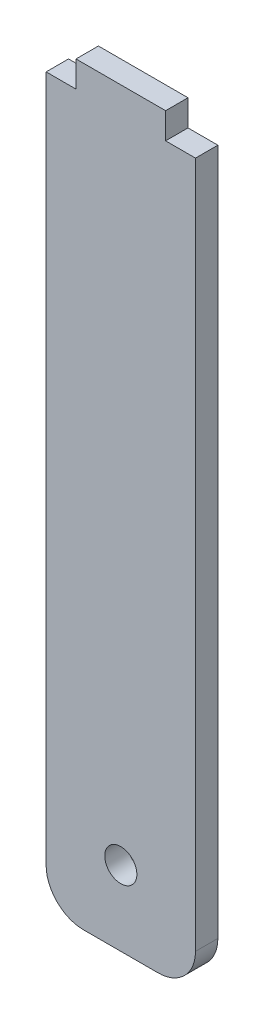
from build123d import *

# Parameters (mm, degrees)
SKETCH_1_R      = 2.15
EXTRUDE_1_DEPTH = 3
FILLET_1_R      = 5


with BuildPart() as part:
    # 草图1 → 凸台-拉伸1 (new body)
    with BuildSketch(Plane.XY):
        Polygon((16, 97), (20, 97), (20, 0), (0, 0), (0, 97), (4, 97), (4, 100.5), (16, 100.5), align=None)
        with Locations((10, 10)):
            Circle(SKETCH_1_R, mode=Mode.SUBTRACT)
    extrude(amount=EXTRUDE_1_DEPTH)

    # 圆角1
    fillet_1_edges = [part.edges().sort_by_distance(p)[0] for p in [
        (20, 0, 1.5),
        (0, 0, 1.5),
    ]]
    fillet(fillet_1_edges, radius=FILLET_1_R)


solid = part.part
